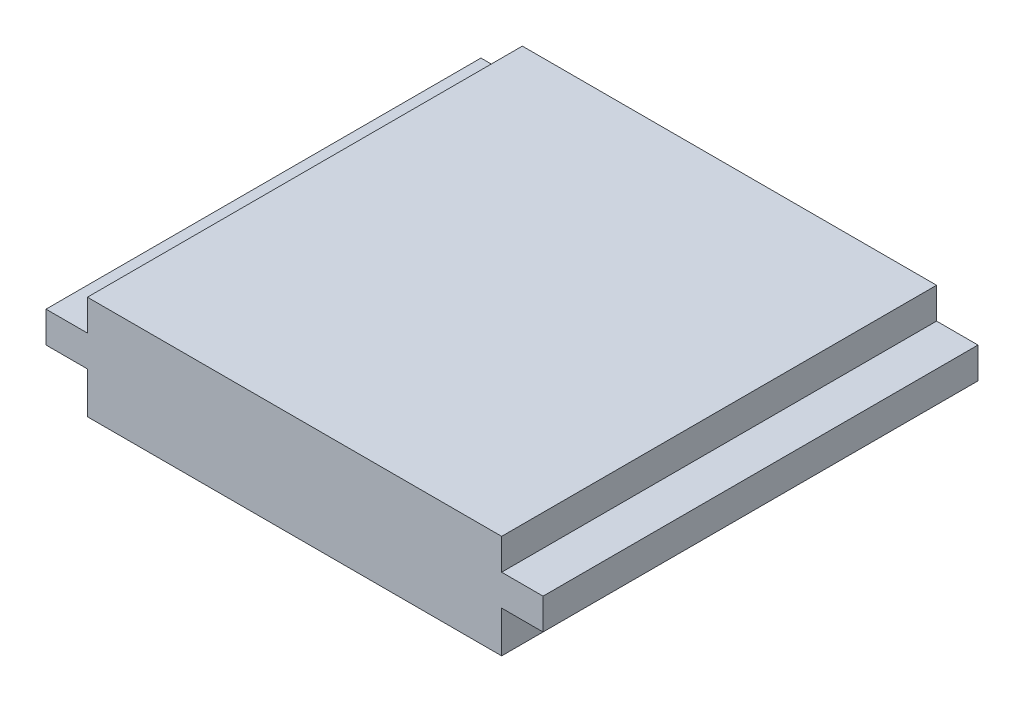
from build123d import *

# Parameters (mm, degrees)
BOSS_EXTRUDE1_DEPTH = 21


with BuildPart() as part:
    # Sketch1 → Boss-Extrude1 (new body)
    with BuildSketch(Plane.XY):
        Polygon((0, 0), (20, 0), (20, 2), (22, 2), (22, 3.5), (20, 3.5), (20, 5), (0, 5), (0, 3.5), (-2, 3.5), (-2, 2), (0, 2), align=None)
    extrude(amount=BOSS_EXTRUDE1_DEPTH)


solid = part.part
